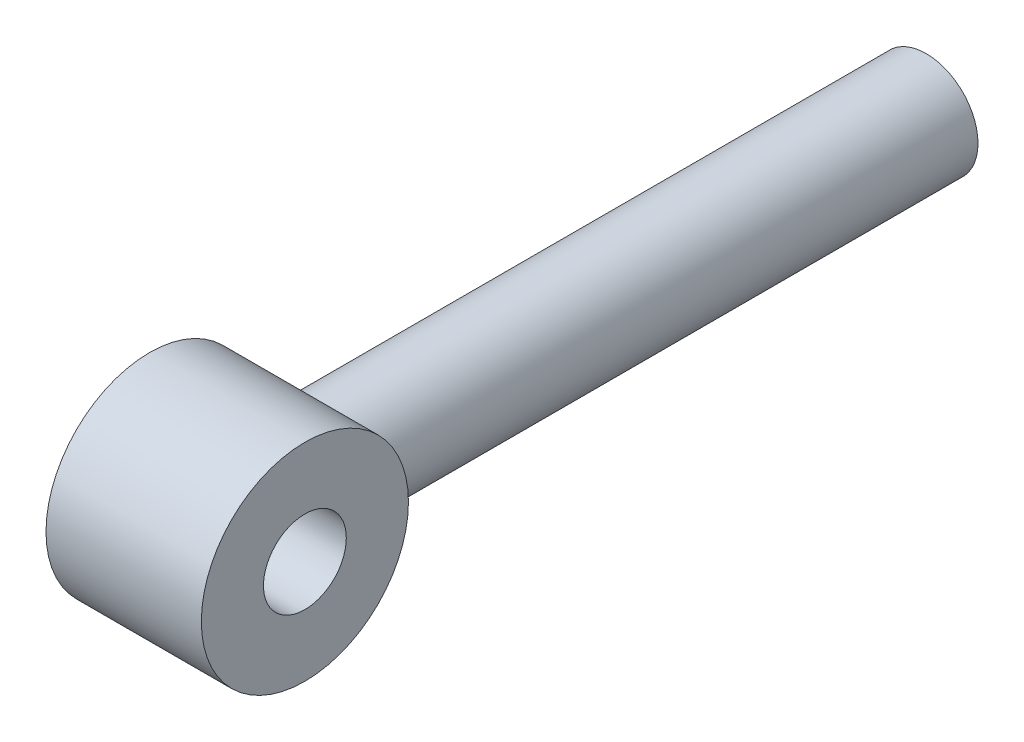
from build123d import *

# Parameters (mm, degrees)
F_0012_CYLINDER_SKETCH_R     = 2
F_0012_CYLINDER_DEPTH        = 24
F_0014_CYLINDER_SKETCH_R     = 4
F_0014_CYLINDER_DEPTH        = 6
F_0014_CYLINDER_ROTATE_ANGLE = 90
F_0016_CYLINDER_SKETCH_R     = 1.6
F_0016_CYLINDER_DEPTH        = 8
F_0016_CYLINDER_ROTATE_ANGLE = 90


with BuildPart() as part:
    # 0012_cylinder_Sketch → 0012_cylinder (new body)
    with BuildSketch(Plane.XY):
        Circle(F_0012_CYLINDER_SKETCH_R)
    extrude(amount=F_0012_CYLINDER_DEPTH)


with BuildPart() as part_1:
    # 0012_cylinder_Translate: moved
    add(part.part.moved(Location((0, 0, -27))))


with BuildPart() as body_2:
    # 0014_cylinder_Sketch → 0014_cylinder (new body)
    with BuildSketch(Plane.XY):
        Circle(F_0014_CYLINDER_SKETCH_R)
    extrude(amount=F_0014_CYLINDER_DEPTH)


with BuildPart() as body_2_1:
    # 0014_cylinder_Rotate: moved
    add(body_2.part.rotate(Axis((0, 0, 0), (0, 1, 0)), F_0014_CYLINDER_ROTATE_ANGLE))


with BuildPart() as body_2_2:
    # 0014_cylinder_Translate: moved
    add(body_2_1.part.moved(Location((-3, 0, 0))))


with BuildPart() as part_2:
    add(part_1.part)

    # 0015_add: union body 2
    add(body_2_2.part)


with BuildPart() as body_2_2_1:
    # 0016_cylinder_Sketch → 0016_cylinder (new body)
    with BuildSketch(Plane.XY):
        Circle(F_0016_CYLINDER_SKETCH_R)
    extrude(amount=F_0016_CYLINDER_DEPTH)


with BuildPart() as body_2_2_2:
    # 0016_cylinder_Rotate: moved
    add(body_2_2_1.part.rotate(Axis((0, 0, 0), (0, 1, 0)), F_0016_CYLINDER_ROTATE_ANGLE))


with BuildPart() as body_2_2_3:
    # 0016_cylinder_Translate: moved
    add(body_2_2_2.part.moved(Location((-4, 0, 0))))


with BuildPart() as part_3:
    add(part_2.part)

    # 0017_sub: cut body 2 2
    add(body_2_2_3.part, mode=Mode.SUBTRACT)


solid = part_3.part
